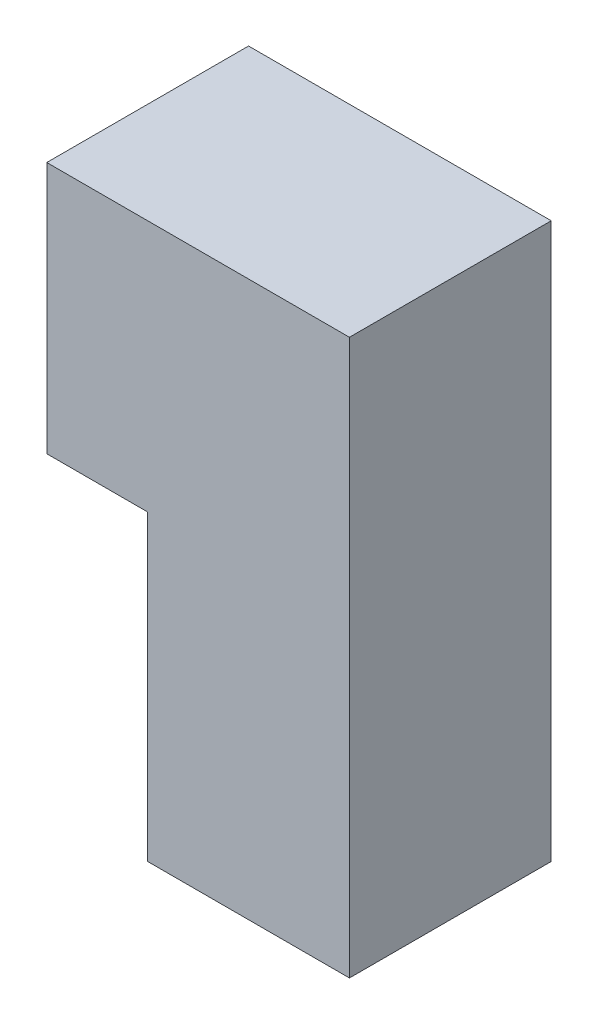
from build123d import *

# Parameters (mm, degrees)
SKETCH_1_W          = 60
SKETCH_1_H          = 50
SKETCH_1_W_2        = 40
SKETCH_1_H_2        = 60
EXTRUDE_1_DEPTH     = 40
SKETCH_3_W          = 20
SKETCH_3_H          = 62.5
CUT_EXTRUDE_1_DEPTH = 30


with BuildPart() as part:
    # 스케치1 → 보스-돌출1 (new body)
    with BuildSketch(Plane.XY):
        with Locations((30, -25)):
            Rectangle(SKETCH_1_W, SKETCH_1_H)
        with Locations((40, -80)):
            Rectangle(SKETCH_1_W_2, SKETCH_1_H_2)
    extrude(amount=EXTRUDE_1_DEPTH)

    # 스케치3 → 컷-돌출1 (cut)
    with BuildSketch(Plane(origin=(0, 0, 0), x_dir=(-1, 0, 0), z_dir=(0, 0, -1))):
        Polygon((0, -37.5), (0, -12.5), (-50, -12.5), (-50, -37.5), (-30, -37.5), align=None)
        with Locations((-40, -68.75)):
            Rectangle(SKETCH_3_W, SKETCH_3_H)
    extrude(amount=-CUT_EXTRUDE_1_DEPTH, mode=Mode.SUBTRACT)


solid = part.part
